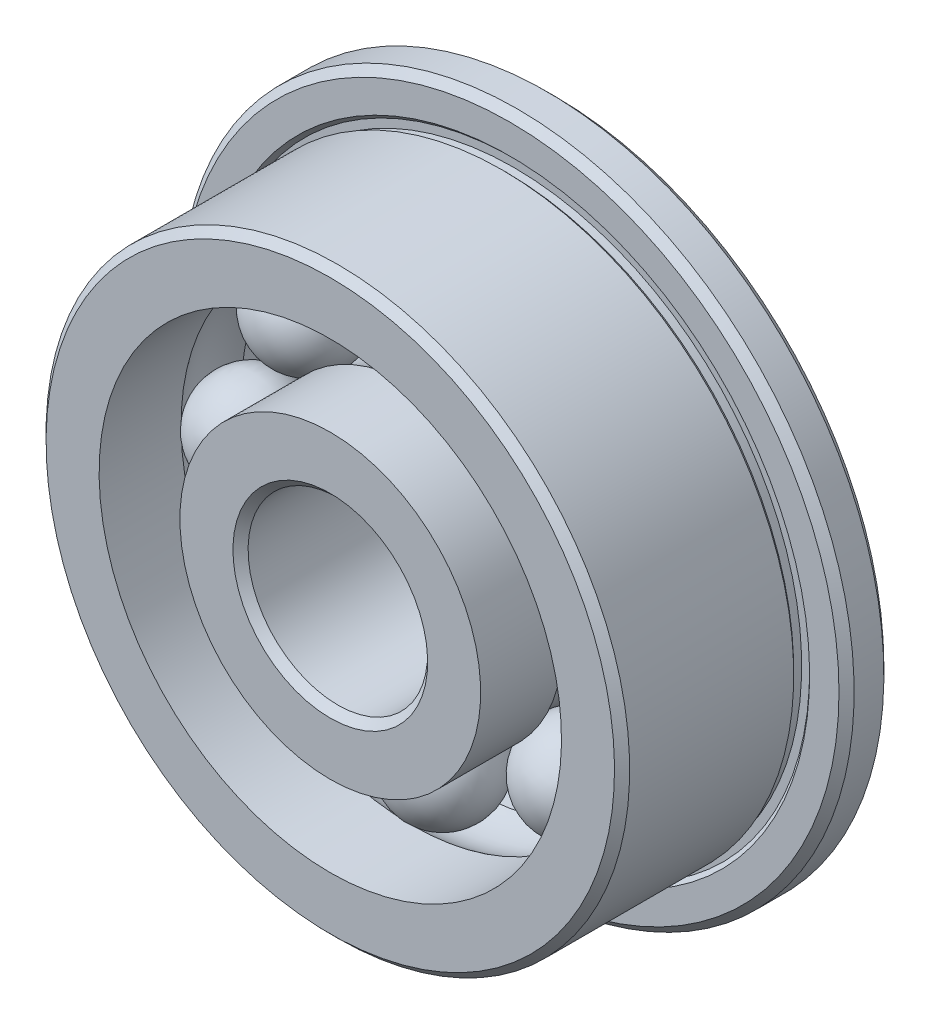
from build123d import *

# Parameters (mm, degrees)
FILLET1_SIZE      = 0.16875
FILLET2_SIZE      = 0.16875
CIRPATTERN3_COUNT = 8


with BuildPart() as part:
    # Sketch2 → Revolve1 (revolve)
    with BuildSketch(Plane(origin=(0, 0, 0), x_dir=(0, 0, -1), z_dir=(1, 0, 0)), mode=Mode.PRIVATE) as revolve1_sk:
        with BuildLine():
            Line((2.5, 7.5), (1.5, 7.5))
            Line((1.5, 7.5), (1.5, 6.676776695))
            Line((1.5, 6.676776695), (1.588388348, 6.588388348))
            Line((1.588388348, 6.588388348), (1.588388348, 6.411611652))
            Line((1.588388348, 6.411611652), (1.411611652, 6.411611652))
            Line((1.411611652, 6.411611652), (1.323223305, 6.5))
            Line((1.323223305, 6.5), (-2.5, 6.5))
            Line((-2.5, 6.5), (-2.5, 5.15))
            Line((-2.5, 5.15), (-0.675, 5.15))
            ThreePointArc((-0.675, 5.15), (0, 5.375), (0.675, 5.15))
            Line((0.675, 5.15), (2.5, 5.15))
            Line((2.5, 5.15), (2.5, 7.5))
        make_face()
        with BuildLine():
            Line((2.5, 2), (-2.5, 2))
            Line((-2.5, 2), (-2.5, 3.35))
            Line((-2.5, 3.35), (-0.675, 3.35))
            ThreePointArc((-0.675, 3.35), (0, 3.125), (0.675, 3.35))
            Line((0.675, 3.35), (2.5, 3.35))
            Line((2.5, 3.35), (2.5, 2))
        make_face()
    revolve(revolve1_sk.sketch.rotate(Axis((0, 0, 0), (0, 0, -1)), 180), axis=Axis((0, 0, 0), (0, 0, -1)))

    # Fillet1
    fillet1_edges = [part.edges().sort_by_distance(p)[0] for p in [
        (0, 6.5, 2.5),
        (0, 7.5, -2.5),
        (0, 7.5, -1.5),
    ]]
    chamfer(fillet1_edges, length=FILLET1_SIZE)

    # Fillet2
    fillet2_edges = [part.edges().sort_by_distance(p)[0] for p in [
        (0, 2, -2.5),
        (0, 2, 2.5),
    ]]
    chamfer(fillet2_edges, length=FILLET2_SIZE)


with BuildPart() as body_2:
    # Sketch7 → Revolve3 (revolve)
    with BuildSketch(Plane.XY):
        with BuildLine():
            Line((0, 5.375), (0, 3.125))
            ThreePointArc((0, 3.125), (-1.125, 4.25), (0, 5.375))
        make_face()
    revolve(axis=Axis((0, 5.375, 0), (0, -1, 0)))


with BuildPart() as cirpattern3_1:
    # CirPattern3: pattern copy
    add(body_2.part.rotate(Axis((0, 0, 0), (0, 0, 1)), 1 * 360 / CIRPATTERN3_COUNT))


with BuildPart() as cirpattern3_2:
    # CirPattern3: pattern copy
    add(body_2.part.rotate(Axis((0, 0, 0), (0, 0, 1)), 2 * 360 / CIRPATTERN3_COUNT))


with BuildPart() as cirpattern3_3:
    # CirPattern3: pattern copy
    add(body_2.part.rotate(Axis((0, 0, 0), (0, 0, 1)), 3 * 360 / CIRPATTERN3_COUNT))


with BuildPart() as cirpattern3_4:
    # CirPattern3: pattern copy
    add(body_2.part.rotate(Axis((0, 0, 0), (0, 0, 1)), 4 * 360 / CIRPATTERN3_COUNT))


with BuildPart() as cirpattern3_5:
    # CirPattern3: pattern copy
    add(body_2.part.rotate(Axis((0, 0, 0), (0, 0, 1)), 5 * 360 / CIRPATTERN3_COUNT))


with BuildPart() as cirpattern3_6:
    # CirPattern3: pattern copy
    add(body_2.part.rotate(Axis((0, 0, 0), (0, 0, 1)), 6 * 360 / CIRPATTERN3_COUNT))


with BuildPart() as cirpattern3_7:
    # CirPattern3: pattern copy
    add(body_2.part.rotate(Axis((0, 0, 0), (0, 0, 1)), 7 * 360 / CIRPATTERN3_COUNT))


solid = Compound([part.part, body_2.part, cirpattern3_1.part, cirpattern3_2.part, cirpattern3_3.part, cirpattern3_4.part, cirpattern3_5.part, cirpattern3_6.part, cirpattern3_7.part])
